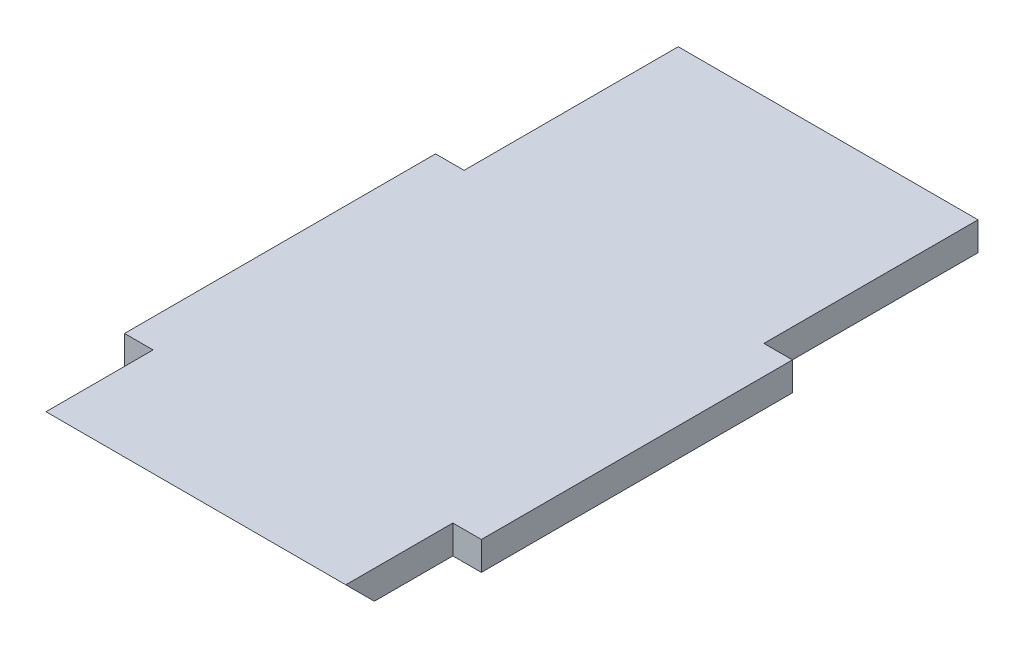
from build123d import *

# Parameters (mm, degrees)
BOSS_EXTRUDE1_DEPTH = 8
CUT_EXTRUDE1_DEPTH  = 200.784047411


with BuildPart() as part:
    # Sketch1 → Boss-Extrude1 (new body)
    with BuildSketch(Plane(origin=(0, 0, 0), x_dir=(1, 0, 0), z_dir=(0, 1, 0))):
        Polygon((8, 117.16), (0, 117.16), (0, 30), (8, 30), (8, 0), (92, 0), (92, 30), (100, 30), (100, 117.16), (92, 117.16), (92, 177.16), (8, 177.16), align=None)
    extrude(amount=BOSS_EXTRUDE1_DEPTH)

    # Sketch2 → Cut-Extrude1 (cut, through all)
    with BuildSketch(Plane.ZY.offset(-8)):
        Polygon((0, 8), (-8, 0), (0, 0), align=None)
    extrude(amount=-CUT_EXTRUDE1_DEPTH, mode=Mode.SUBTRACT)


solid = part.part
